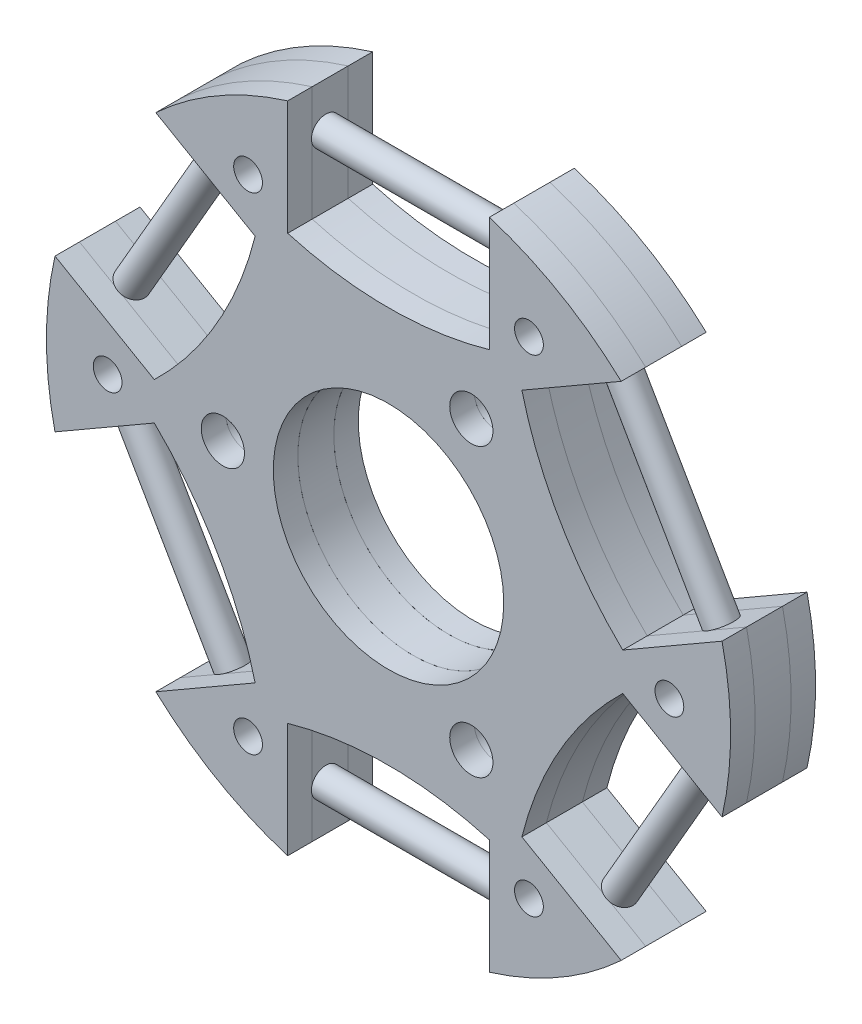
from build123d import *

# Parameters (mm, degrees)
SKETCH_1_R               = 25.4
SKETCH_1_R_2             = 8
EXTRUDE_1_DEPTH          = 1.7
SKETCH_2_R               = 25.4
SKETCH_2_R_2             = 3.5
EXTRUDE_2_DEPTH          = 2.5
SKETCH_3_R               = 25.4
SKETCH_3_R_2             = 8
EXTRUDE_3_DEPTH          = 1.7
CUT_EXTRUDE_START        = -20.5
CUT_EXTRUDE_1_DEPTH      = 20.5
SKETCH_5_R               = 1
CUT_EXTRUDE_2_DEPTH      = 20.5
SKETCH_6_R               = 1
EXTRUDE_4_DEPTH          = 14
PATTERN_CIRCULAR_1_COUNT = 6
SKETCH_7_R               = 1
CUT_EXTRUDE_3_DEPTH      = 14
CUT_EXTRUDE_START_2      = -10
SKETCH_8_R               = 25.4
SKETCH_8_R_2             = 23.75
CUT_EXTRUDE_4_DEPTH      = 10
SKETCH_9_R               = 8
CUT_EXTRUDE_5_DEPTH      = 34.117442534
SKETCH_10_R              = 1.5
CUT_EXTRUDE_6_DEPTH      = 34.375664787


with BuildPart() as part:
    # 草图1 → 凸台-拉伸1 (new body)
    with BuildSketch(Plane.XY):
        Circle(SKETCH_1_R)
        Circle(SKETCH_1_R_2, mode=Mode.SUBTRACT)
    extrude(amount=EXTRUDE_1_DEPTH)


with BuildPart() as body_2:
    # 草图2 → 凸台-拉伸2 (new body)
    with BuildSketch(Plane.XY.offset(1.7)):
        Circle(SKETCH_2_R)
        Circle(SKETCH_2_R_2, mode=Mode.SUBTRACT)
    extrude(amount=EXTRUDE_2_DEPTH)


with BuildPart() as body_3:
    # 草图3 → 凸台-拉伸3 (new body)
    with BuildSketch(Plane.XY.offset(4.2)):
        Circle(SKETCH_3_R)
        Circle(SKETCH_3_R_2, mode=Mode.SUBTRACT)
    extrude(amount=EXTRUDE_3_DEPTH)


with BuildPart() as cut_extrude_1_tool:
    # 草图4 → 切除-拉伸1 (new body)
    with BuildSketch(Plane.XY.offset(5.9).offset(CUT_EXTRUDE_START)):
        with BuildLine():
            Line((9.259682334, 13.428983857), (17.645212224, 18.270371796))
            ThreePointArc((17.645212224, 18.270371796), (21.997045256, 12.7), (24.645212224, 6.146016143))
            Line((24.645212224, 6.146016143), (16.259682334, 1.304628204))
            ThreePointArc((16.259682334, 1.304628204), (11.907849302, 6.875), (9.259682334, 13.428983857))
        make_face()
        with BuildLine():
            Line((7, 14.733612061), (7, 24.416387939))
            ThreePointArc((7, 24.416387939), (0, 25.4), (-7, 24.416387939))
            Line((-7, 24.416387939), (-7, 14.733612061))
            ThreePointArc((-7, 14.733612061), (0, 13.75), (7, 14.733612061))
        make_face()
        with BuildLine():
            Line((16.259682334, -1.304628204), (24.645212224, -6.146016143))
            ThreePointArc((24.645212224, -6.146016143), (21.997045256, -12.7), (17.645212224, -18.270371796))
            Line((17.645212224, -18.270371796), (9.259682334, -13.428983857))
            ThreePointArc((9.259682334, -13.428983857), (11.907849302, -6.875), (16.259682334, -1.304628204))
        make_face()
        with BuildLine():
            Line((7, -14.733612061), (7, -24.416387939))
            ThreePointArc((7, -24.416387939), (0, -25.4), (-7, -24.416387939))
            Line((-7, -24.416387939), (-7, -14.733612061))
            ThreePointArc((-7, -14.733612061), (0, -13.75), (7, -14.733612061))
        make_face()
        with BuildLine():
            Line((-9.259682334, -13.428983857), (-17.645212224, -18.270371796))
            ThreePointArc((-17.645212224, -18.270371796), (-21.997045256, -12.7), (-24.645212224, -6.146016143))
            Line((-24.645212224, -6.146016143), (-16.259682334, -1.304628204))
            ThreePointArc((-16.259682334, -1.304628204), (-11.907849302, -6.875), (-9.259682334, -13.428983857))
        make_face()
        with BuildLine():
            Line((-16.259682334, 1.304628204), (-24.645212224, 6.146016143))
            ThreePointArc((-24.645212224, 6.146016143), (-21.997045256, 12.7), (-17.645212224, 18.270371796))
            Line((-17.645212224, 18.270371796), (-9.259682334, 13.428983857))
            ThreePointArc((-9.259682334, 13.428983857), (-11.907849302, 6.875), (-16.259682334, 1.304628204))
        make_face()
    extrude(amount=CUT_EXTRUDE_1_DEPTH)


with BuildPart() as part_1:
    add(part.part)

    # 切除-拉伸1: cut by cut_extrude_1_tool
    add(cut_extrude_1_tool.part, mode=Mode.SUBTRACT)


with BuildPart() as body_2_1:
    add(body_2.part)

    # 切除-拉伸1: cut by cut_extrude_1_tool
    add(cut_extrude_1_tool.part, mode=Mode.SUBTRACT)


with BuildPart() as body_3_1:
    add(body_3.part)

    # 切除-拉伸1: cut by cut_extrude_1_tool
    add(cut_extrude_1_tool.part, mode=Mode.SUBTRACT)


with BuildPart() as cut_extrude_2_tool:
    # 草图5 → 切除-拉伸2 (new body)
    with BuildSketch(Plane.XY.offset(5.9)):
        with Locations((9.75, 16.887495374)):
            Circle(SKETCH_5_R)
        with Locations((19.5, 0)):
            Circle(SKETCH_5_R)
        with Locations((9.75, -16.887495374)):
            Circle(SKETCH_5_R)
        with Locations((-9.75, -16.887495374)):
            Circle(SKETCH_5_R)
        with Locations((-19.5, 0)):
            Circle(SKETCH_5_R)
        with Locations((-9.75, 16.887495374)):
            Circle(SKETCH_5_R)
    extrude(amount=-CUT_EXTRUDE_2_DEPTH)


with BuildPart() as part_2:
    add(part_1.part)

    # 切除-拉伸2: cut by cut_extrude_2_tool
    add(cut_extrude_2_tool.part, mode=Mode.SUBTRACT)


with BuildPart() as body_2_2:
    add(body_2_1.part)

    # 切除-拉伸2: cut by cut_extrude_2_tool
    add(cut_extrude_2_tool.part, mode=Mode.SUBTRACT)

    # 草图6 → 凸台-拉伸4 (add)
    with BuildSketch(Plane(origin=(-7, 0, 0), x_dir=(0, 0, -1), z_dir=(1, 0, 0))):
        with Locations(Location((-3.25, 19.575, 0), (0, 0, 198.194872339))):
            Circle(SKETCH_6_R)
    extrude_4 = extrude(amount=EXTRUDE_4_DEPTH)

    # 阵列(圆周)1: 凸台-拉伸4 ×6 about axis
    pattern_circular_1_axis = Axis((0, 0, 0), (0, 0, 1))
    for i in range(1, PATTERN_CIRCULAR_1_COUNT):
        add(extrude_4.rotate(pattern_circular_1_axis, i * 360 / PATTERN_CIRCULAR_1_COUNT))

    # 草图7 → 切除-拉伸3 (cut)
    with BuildSketch(Plane.XY.offset(4.2)):
        with Locations((0, 7)):
            Circle(SKETCH_7_R)
        with Locations((7, 0)):
            Circle(SKETCH_7_R)
        with Locations((0, -7)):
            Circle(SKETCH_7_R)
        with Locations((-7, 0)):
            Circle(SKETCH_7_R)
    extrude(amount=-CUT_EXTRUDE_3_DEPTH, mode=Mode.SUBTRACT)


with BuildPart() as body_3_2:
    add(body_3_1.part)

    # 切除-拉伸2: cut by cut_extrude_2_tool
    add(cut_extrude_2_tool.part, mode=Mode.SUBTRACT)


with BuildPart() as cut_extrude_4_tool:
    # 草图8 → 切除-拉伸4 (new body)
    with BuildSketch(Plane.XY.offset(5.9).offset(CUT_EXTRUDE_START_2)):
        Circle(SKETCH_8_R)
        Circle(SKETCH_8_R_2, mode=Mode.SUBTRACT)
    extrude(amount=CUT_EXTRUDE_4_DEPTH)


with BuildPart() as part_3:
    add(part_2.part)

    # 切除-拉伸4: cut by cut_extrude_4_tool
    add(cut_extrude_4_tool.part, mode=Mode.SUBTRACT)


with BuildPart() as body_2_3:
    add(body_2_2.part)

    # 切除-拉伸4: cut by cut_extrude_4_tool
    add(cut_extrude_4_tool.part, mode=Mode.SUBTRACT)

    # 草图9 → 切除-拉伸5 (cut, through all)
    with BuildSketch(Plane(origin=(0, 0, 1.7), x_dir=(-1, 0, 0), z_dir=(0, 0, -1))):
        with Locations(Location((0, 0, 0), (0, 0, 180))):
            Circle(SKETCH_9_R)
    extrude(amount=-CUT_EXTRUDE_5_DEPTH, mode=Mode.SUBTRACT)


with BuildPart() as body_3_3:
    add(body_3_2.part)

    # 切除-拉伸4: cut by cut_extrude_4_tool
    add(cut_extrude_4_tool.part, mode=Mode.SUBTRACT)


with BuildPart() as cut_extrude_6_tool:
    # 草图10 → 切除-拉伸6 (new, through all)
    with BuildSketch(Plane(origin=(0, 0, 0), x_dir=(-1, 0, 0), z_dir=(0, 0, -1))):
        with Locations((-5.75, 9.959292144)):
            Circle(SKETCH_10_R)
        with Locations((11.5, 0)):
            Circle(SKETCH_10_R)
        with Locations((-5.75, -9.959292144)):
            Circle(SKETCH_10_R)
    extrude(amount=-CUT_EXTRUDE_6_DEPTH)


with BuildPart() as part_4:
    add(part_3.part)

    # 切除-拉伸6: cut by cut_extrude_6_tool
    add(cut_extrude_6_tool.part, mode=Mode.SUBTRACT)


with BuildPart() as body_2_4:
    add(body_2_3.part)

    # 切除-拉伸6: cut by cut_extrude_6_tool
    add(cut_extrude_6_tool.part, mode=Mode.SUBTRACT)


with BuildPart() as body_3_4:
    add(body_3_3.part)

    # 切除-拉伸6: cut by cut_extrude_6_tool
    add(cut_extrude_6_tool.part, mode=Mode.SUBTRACT)


solid = Compound([part_4.part, body_2_4.part, body_3_4.part])
